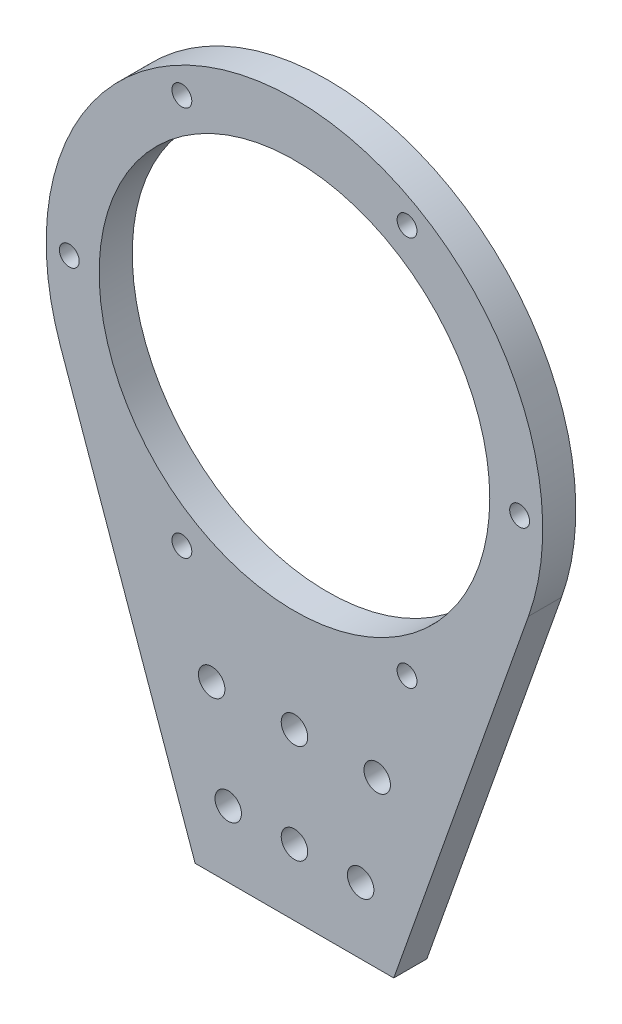
from build123d import *

# Parameters (mm, degrees)
SKETCH1_R           = 37.5
SKETCH1_R_2         = 29.5
BOSS_EXTRUDE1_DEPTH = 5
SKETCH12_R          = 2
CUT_EXTRUDE8_DEPTH  = 7
SKETCH9_R           = 1.5
CUT_EXTRUDE5_DEPTH  = 7


with BuildPart() as part:
    # Sketch1 → Boss-Extrude1 (new body)
    # profile 1 of 2: a face of its own
    with BuildSketch(Plane.XY):
        Circle(SKETCH1_R)
        Circle(SKETCH1_R_2, mode=Mode.SUBTRACT)
    # profile 2 of 2: a face of its own
    with BuildSketch(Plane.XY):
        with BuildLine():
            Line((-15, -70), (15, -70))
            Line((15, -70), (35.350308448, -12.514219618))
            ThreePointArc((35.350308448, -12.514219618), (0, -37.5), (-35.350308448, -12.514219618))
            Line((-35.350308448, -12.514219618), (-15, -70))
        make_face()
    extrude(amount=BOSS_EXTRUDE1_DEPTH)

    # Sketch12 → Cut-Extrude8 (cut)
    with BuildSketch(Plane(origin=(0, 0, 0), x_dir=(-1, 0, 0), z_dir=(0, 0, -1))):
        with Locations((-12.5, -45)):
            Circle(SKETCH12_R)
        with Locations((12.5, -45)):
            Circle(SKETCH12_R)
        with Locations((-10, -60)):
            Circle(SKETCH12_R)
        with Locations((10, -60)):
            Circle(SKETCH12_R)
        with Locations((0, -45)):
            Circle(SKETCH12_R)
        with Locations((0, -60)):
            Circle(SKETCH12_R)
    extrude(amount=-CUT_EXTRUDE8_DEPTH, mode=Mode.SUBTRACT)

    # Sketch9 → Cut-Extrude5 (cut)
    with BuildSketch(Plane.XY.offset(5)):
        with Locations((17.005, 29.453523983)):
            Circle(SKETCH9_R)
        with Locations((34.01, 0)):
            Circle(SKETCH9_R)
        with Locations((17.005, -29.453523983)):
            Circle(SKETCH9_R)
        with Locations((-17.005, -29.453523983)):
            Circle(SKETCH9_R)
        with Locations((-34.01, 0)):
            Circle(SKETCH9_R)
        with Locations((-17.005, 29.453523983)):
            Circle(SKETCH9_R)
    extrude(amount=-CUT_EXTRUDE5_DEPTH, mode=Mode.SUBTRACT)


solid = part.part
